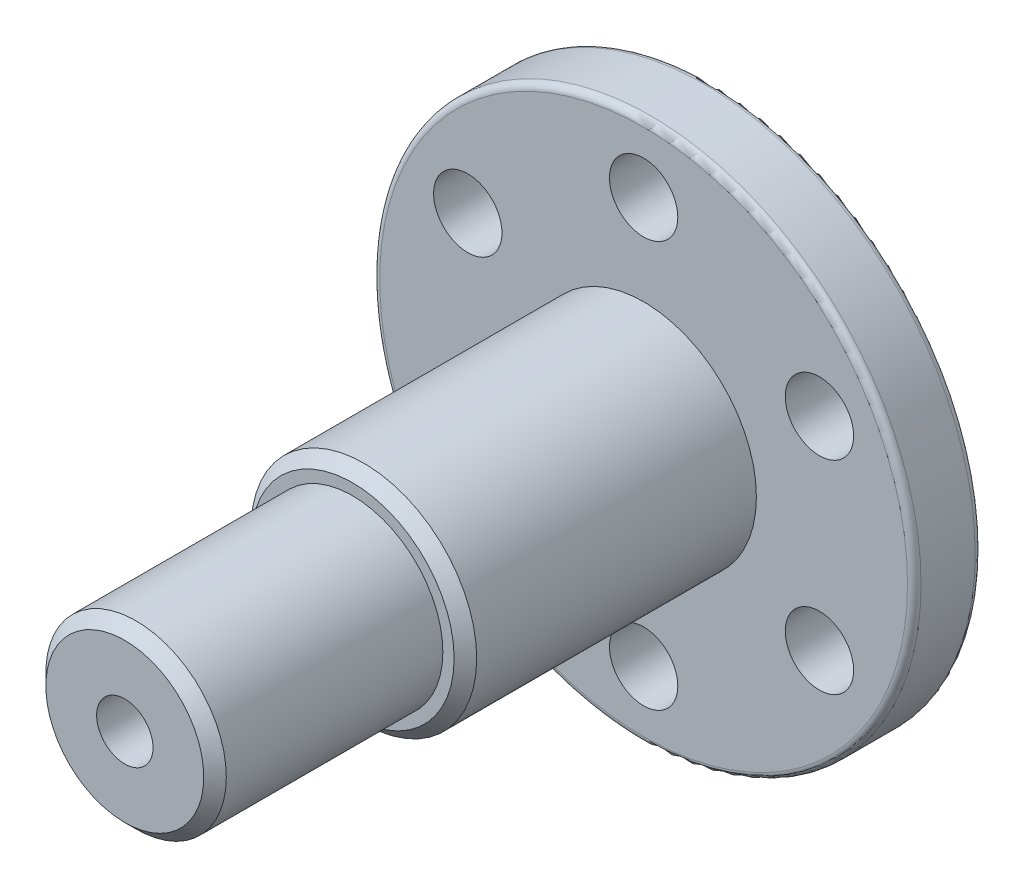
from build123d import *

# Parameters (mm, degrees)
SKETCH_1_R             = 12
SKETCH_1_R_2           = 1.515
EXTRUDE_1_DEPTH        = 3
SKETCH_2_R             = 5
EXTRUDE_2_DEPTH        = 23
SKETCH_3_OUTSIDE_W     = 34.552
SKETCH_3_OUTSIDE_H     = 34.552
SKETCH_3_OUTSIDE_R     = 4
CUT_EXTRUDE_1_DEPTH    = 10.1
CHAMFER_1_SIZE         = 0.5
FILLET_1_R             = 0.3
HOLE_WIZARD_M3_1_D     = 2.5
HOLE_WIZARD_M3_1_DEPTH = 9.5
HOLE_WIZARD_M3_1_TIP   = 0.751075774


with BuildPart() as part:
    # 草图1 → 凸台-拉伸1 (new body)
    with BuildSketch(Plane.XY):
        Circle(SKETCH_1_R)
        with Locations((0, 9)):
            Circle(SKETCH_1_R_2, mode=Mode.SUBTRACT)
        with Locations((7.794228634, 4.5)):
            Circle(SKETCH_1_R_2, mode=Mode.SUBTRACT)
        with Locations((7.794228634, -4.5)):
            Circle(SKETCH_1_R_2, mode=Mode.SUBTRACT)
        with Locations((0, -9)):
            Circle(SKETCH_1_R_2, mode=Mode.SUBTRACT)
        with Locations((-7.794228634, -4.5)):
            Circle(SKETCH_1_R_2, mode=Mode.SUBTRACT)
        with Locations((-7.794228634, 4.5)):
            Circle(SKETCH_1_R_2, mode=Mode.SUBTRACT)
    extrude(amount=EXTRUDE_1_DEPTH)

    # 草图2 → 凸台-拉伸2 (add)
    with BuildSketch(Plane.XY.offset(3)):
        Circle(SKETCH_2_R)
    extrude(amount=EXTRUDE_2_DEPTH)

    # 草图3 outside → 切除-拉伸1 (cut)
    with BuildSketch(Plane.XY.offset(26)):
        Rectangle(SKETCH_3_OUTSIDE_W, SKETCH_3_OUTSIDE_H)
        Circle(SKETCH_3_OUTSIDE_R, mode=Mode.SUBTRACT)
    extrude(amount=-CUT_EXTRUDE_1_DEPTH, mode=Mode.SUBTRACT)

    # 倒角1
    chamfer_1_edges = [part.edges().sort_by_distance(p)[0] for p in [
        (-4, 0, 26),
        (-5, 0, 15.9),
    ]]
    chamfer(chamfer_1_edges, length=CHAMFER_1_SIZE)

    # 圆角1
    fillet_1_edges = [part.edges().sort_by_distance(p)[0] for p in [
        (-12, 0, 0),
        (-12, 0, 3),
    ]]
    fillet(fillet_1_edges, radius=FILLET_1_R)

    # M3 螺纹孔1
    with Locations(Plane.XY.offset(26)):
        with Locations((0, 0)):
            Hole(HOLE_WIZARD_M3_1_D / 2, depth=HOLE_WIZARD_M3_1_DEPTH)
            with Locations((0, 0, -(HOLE_WIZARD_M3_1_DEPTH + HOLE_WIZARD_M3_1_TIP / 2))):  # 118° drill point
                Cone(0, HOLE_WIZARD_M3_1_D / 2, HOLE_WIZARD_M3_1_TIP, mode=Mode.SUBTRACT)


solid = part.part
